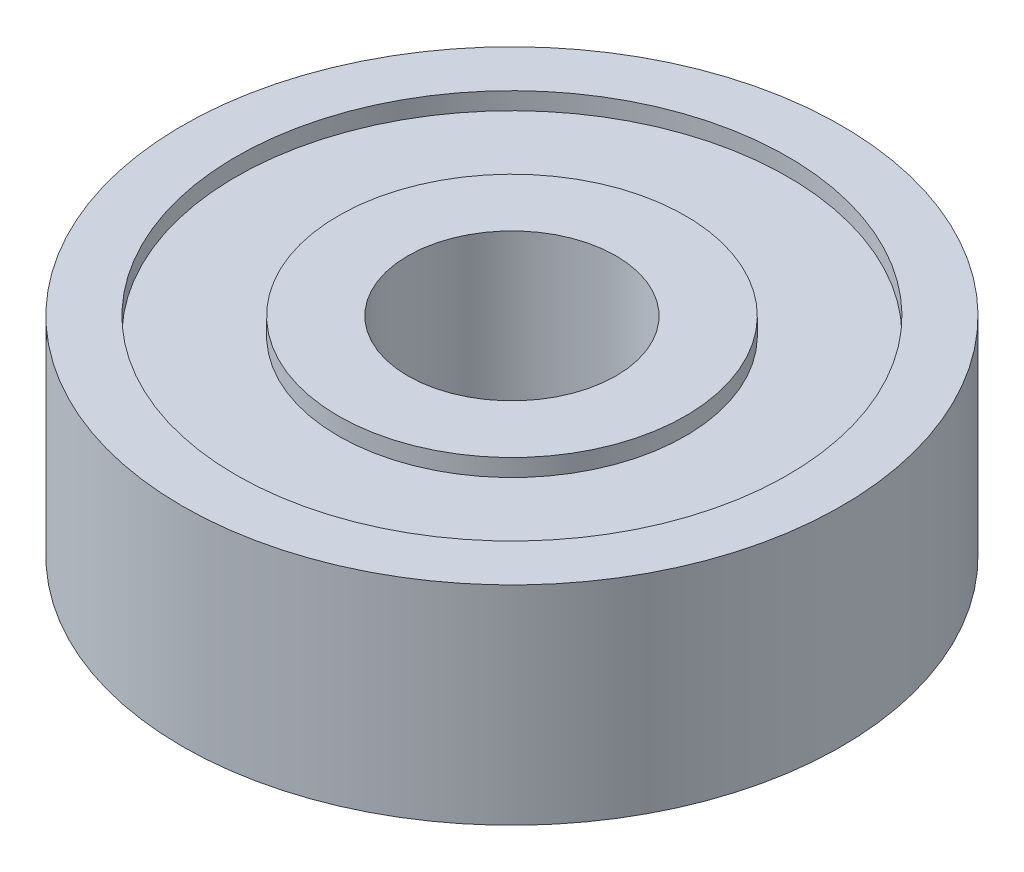
from build123d import *

# Parameters (mm, degrees)
SKETCH1_R           = 9.5
SKETCH1_R_2         = 3
BOSS_EXTRUDE1_DEPTH = 6
SKETCH2_R           = 7.95
SKETCH2_R_2         = 5.001453451
CUT_EXTRUDE1_DEPTH  = 0.5
CUT_EXTRUDE2_START  = -0.5
SKETCH3_R           = 7.95
SKETCH3_R_2         = 5.002476721
CUT_EXTRUDE2_DEPTH  = 0.5


with BuildPart() as part:
    # Sketch1 → Boss-Extrude1 (new body)
    with BuildSketch(Plane(origin=(0, 0, 0), x_dir=(1, 0, 0), z_dir=(0, 1, 0))):
        with Locations(Location((0, 0, 0), (0, 0, 270))):
            Circle(SKETCH1_R)
        with Locations(Location((0, 0, 0), (0, 0, 270))):
            Circle(SKETCH1_R_2, mode=Mode.SUBTRACT)
    extrude(amount=BOSS_EXTRUDE1_DEPTH)

    # Sketch2 → Cut-Extrude1 (cut)
    with BuildSketch(Plane(origin=(0, 6, 0), x_dir=(1, 0, 0), z_dir=(0, 1, 0))):
        with Locations(Location((0, 0, 0), (0, 0, 270))):
            Circle(SKETCH2_R)
        with Locations(Location((0, 0, 0), (0, 0, 270))):
            Circle(SKETCH2_R_2, mode=Mode.SUBTRACT)
    extrude(amount=-CUT_EXTRUDE1_DEPTH, mode=Mode.SUBTRACT)

    # Sketch3 → Cut-Extrude2 (cut)
    with BuildSketch(Plane.XZ.offset(CUT_EXTRUDE2_START)):
        with Locations(Location((0, 0, 0), (0, 0, 90))):
            Circle(SKETCH3_R)
        with Locations(Location((0, 0, 0), (0, 0, 270))):
            Circle(SKETCH3_R_2, mode=Mode.SUBTRACT)
    extrude(amount=CUT_EXTRUDE2_DEPTH, mode=Mode.SUBTRACT)


solid = part.part
